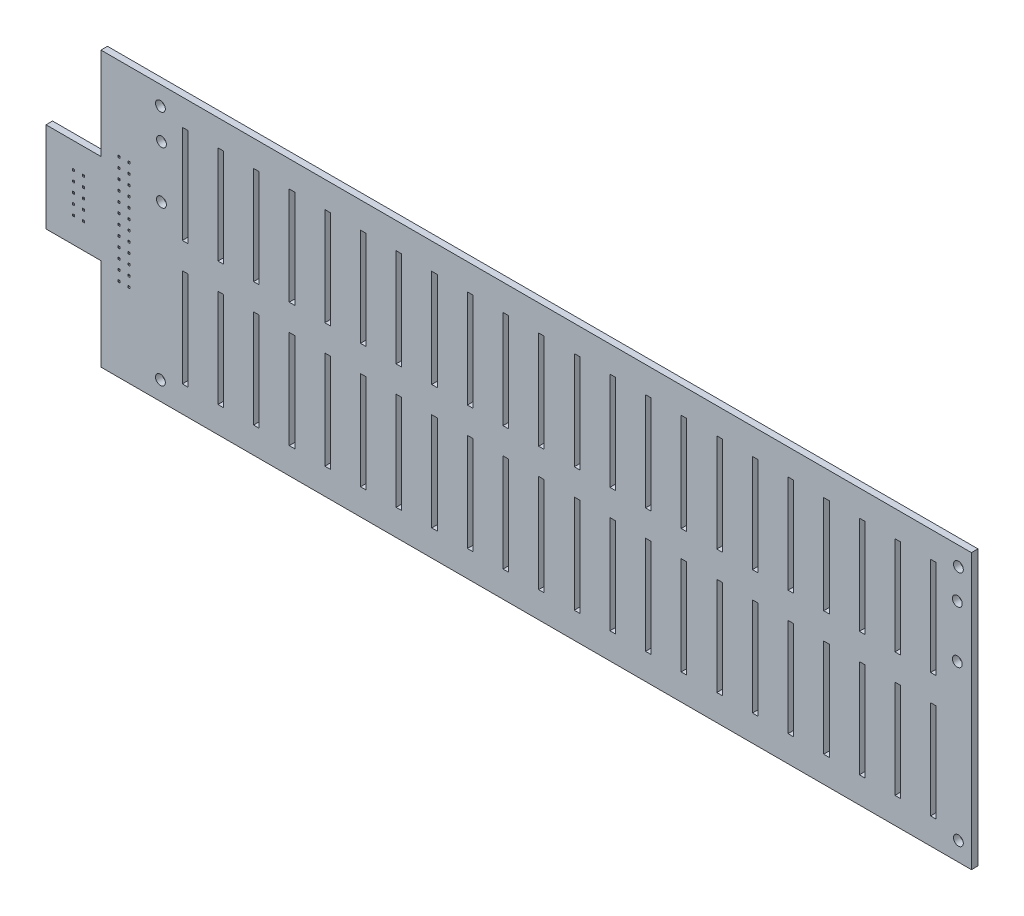
from build123d import *

# Parameters (mm, degrees)
MODEL_R             = 1.5
MODEL_W             = 0.64
MODEL_H             = 0.64
MODEL_W_2           = 1.7
MODEL_H_2           = 30
BOSS_EXTRUDE1_DEPTH = 2


with BuildPart() as part:
    # Model → Boss-Extrude1 (new body)
    with BuildSketch(Plane.XY):
        Polygon((-140.24, -42), (126.05, -42), (126.05, 42), (-140.24, 42), (-140.24, 13.8), (-157.05, 13.8), (-157.05, -13.8), (-140.24, -13.8), align=None)
        with Locations((-122.05, 36.25)):
            Circle(MODEL_R, mode=Mode.SUBTRACT)
        with Locations((-122.05, -36.25)):
            Circle(MODEL_R, mode=Mode.SUBTRACT)
        with Locations((122.05, -36.25)):
            Circle(MODEL_R, mode=Mode.SUBTRACT)
        with Locations((122.05, 36.25)):
            Circle(MODEL_R, mode=Mode.SUBTRACT)
        with Locations((121.73, 27)):
            Circle(MODEL_R, mode=Mode.SUBTRACT)
        with Locations((121.73, 11)):
            Circle(MODEL_R, mode=Mode.SUBTRACT)
        with Locations((-121.73, 11)):
            Circle(MODEL_R, mode=Mode.SUBTRACT)
        with Locations((-121.73, 27)):
            Circle(MODEL_R, mode=Mode.SUBTRACT)
        with Locations((-131.71, -1.5)):
            Rectangle(MODEL_W, MODEL_H, mode=Mode.SUBTRACT)
        with Locations((-134.71, 1.5)):
            Rectangle(MODEL_W, MODEL_H, mode=Mode.SUBTRACT)
        with Locations((-131.71, 1.5)):
            Rectangle(MODEL_W, MODEL_H, mode=Mode.SUBTRACT)
        with Locations((-134.71, 4.5)):
            Rectangle(MODEL_W, MODEL_H, mode=Mode.SUBTRACT)
        with Locations((-131.71, -7.5)):
            Rectangle(MODEL_W, MODEL_H, mode=Mode.SUBTRACT)
        with Locations((-134.71, -4.5)):
            Rectangle(MODEL_W, MODEL_H, mode=Mode.SUBTRACT)
        with Locations((-131.71, -4.5)):
            Rectangle(MODEL_W, MODEL_H, mode=Mode.SUBTRACT)
        with Locations((-134.71, -1.5)):
            Rectangle(MODEL_W, MODEL_H, mode=Mode.SUBTRACT)
        with Locations((-134.71, 10.5)):
            Rectangle(MODEL_W, MODEL_H, mode=Mode.SUBTRACT)
        with Locations((-134.71, 13.5)):
            Rectangle(MODEL_W, MODEL_H, mode=Mode.SUBTRACT)
        with Locations((-131.71, 13.5)):
            Rectangle(MODEL_W, MODEL_H, mode=Mode.SUBTRACT)
        with Locations((-134.71, 16.5)):
            Rectangle(MODEL_W, MODEL_H, mode=Mode.SUBTRACT)
        with Locations((-131.71, 4.5)):
            Rectangle(MODEL_W, MODEL_H, mode=Mode.SUBTRACT)
        with Locations((-134.71, 7.5)):
            Rectangle(MODEL_W, MODEL_H, mode=Mode.SUBTRACT)
        with Locations((-131.71, 7.5)):
            Rectangle(MODEL_W, MODEL_H, mode=Mode.SUBTRACT)
        with Locations((-131.71, 10.5)):
            Rectangle(MODEL_W, MODEL_H, mode=Mode.SUBTRACT)
        with Locations((-145.58, 0)):
            Rectangle(MODEL_W, MODEL_H, mode=Mode.SUBTRACT)
        with Locations((-148.58, 3)):
            Rectangle(MODEL_W, MODEL_H, mode=Mode.SUBTRACT)
        with Locations((-145.58, 3)):
            Rectangle(MODEL_W, MODEL_H, mode=Mode.SUBTRACT)
        with Locations((-148.58, 6)):
            Rectangle(MODEL_W, MODEL_H, mode=Mode.SUBTRACT)
        with Locations((-145.58, -6)):
            Rectangle(MODEL_W, MODEL_H, mode=Mode.SUBTRACT)
        with Locations((-148.58, -3)):
            Rectangle(MODEL_W, MODEL_H, mode=Mode.SUBTRACT)
        with Locations((-145.58, -3)):
            Rectangle(MODEL_W, MODEL_H, mode=Mode.SUBTRACT)
        with Locations((-148.58, 0)):
            Rectangle(MODEL_W, MODEL_H, mode=Mode.SUBTRACT)
        with Locations((-131.71, -13.5)):
            Rectangle(MODEL_W, MODEL_H, mode=Mode.SUBTRACT)
        with Locations((-134.71, -10.5)):
            Rectangle(MODEL_W, MODEL_H, mode=Mode.SUBTRACT)
        with Locations((-131.71, -10.5)):
            Rectangle(MODEL_W, MODEL_H, mode=Mode.SUBTRACT)
        with Locations((-134.71, -7.5)):
            Rectangle(MODEL_W, MODEL_H, mode=Mode.SUBTRACT)
        with Locations((-145.58, 6)):
            Rectangle(MODEL_W, MODEL_H, mode=Mode.SUBTRACT)
        with Locations((-134.71, -16.5)):
            Rectangle(MODEL_W, MODEL_H, mode=Mode.SUBTRACT)
        with Locations((-131.71, -16.5)):
            Rectangle(MODEL_W, MODEL_H, mode=Mode.SUBTRACT)
        with Locations((-134.71, -13.5)):
            Rectangle(MODEL_W, MODEL_H, mode=Mode.SUBTRACT)
        with Locations((-131.71, 16.5)):
            Rectangle(MODEL_W, MODEL_H, mode=Mode.SUBTRACT)
        with Locations((-148.58, -6)):
            Rectangle(MODEL_W, MODEL_H, mode=Mode.SUBTRACT)
        with Locations((-103.6, 19)):
            Rectangle(MODEL_W_2, MODEL_H_2, mode=Mode.SUBTRACT)
        with Locations((-92.7, 19)):
            Rectangle(MODEL_W_2, MODEL_H_2, mode=Mode.SUBTRACT)
        with Locations((-81.8, 19)):
            Rectangle(MODEL_W_2, MODEL_H_2, mode=Mode.SUBTRACT)
        with Locations((-70.9, 19)):
            Rectangle(MODEL_W_2, MODEL_H_2, mode=Mode.SUBTRACT)
        with Locations((-60, 19)):
            Rectangle(MODEL_W_2, MODEL_H_2, mode=Mode.SUBTRACT)
        with Locations((-49.1, 19)):
            Rectangle(MODEL_W_2, MODEL_H_2, mode=Mode.SUBTRACT)
        with Locations((-38.2, 19)):
            Rectangle(MODEL_W_2, MODEL_H_2, mode=Mode.SUBTRACT)
        with Locations((-27.3, 19)):
            Rectangle(MODEL_W_2, MODEL_H_2, mode=Mode.SUBTRACT)
        with Locations((-16.4, 19)):
            Rectangle(MODEL_W_2, MODEL_H_2, mode=Mode.SUBTRACT)
        with Locations((-114.5, 19)):
            Rectangle(MODEL_W_2, MODEL_H_2, mode=Mode.SUBTRACT)
        with Locations((-5.5, 19)):
            Rectangle(MODEL_W_2, MODEL_H_2, mode=Mode.SUBTRACT)
        with Locations((5.4, 19)):
            Rectangle(MODEL_W_2, MODEL_H_2, mode=Mode.SUBTRACT)
        with Locations((16.3, 19)):
            Rectangle(MODEL_W_2, MODEL_H_2, mode=Mode.SUBTRACT)
        with Locations((27.2, 19)):
            Rectangle(MODEL_W_2, MODEL_H_2, mode=Mode.SUBTRACT)
        with Locations((38.1, 19)):
            Rectangle(MODEL_W_2, MODEL_H_2, mode=Mode.SUBTRACT)
        with Locations((49, 19)):
            Rectangle(MODEL_W_2, MODEL_H_2, mode=Mode.SUBTRACT)
        with Locations((59.9, 19)):
            Rectangle(MODEL_W_2, MODEL_H_2, mode=Mode.SUBTRACT)
        with Locations((70.8, 19)):
            Rectangle(MODEL_W_2, MODEL_H_2, mode=Mode.SUBTRACT)
        with Locations((81.7, 19)):
            Rectangle(MODEL_W_2, MODEL_H_2, mode=Mode.SUBTRACT)
        with Locations((92.6, 19)):
            Rectangle(MODEL_W_2, MODEL_H_2, mode=Mode.SUBTRACT)
        with Locations((103.5, 19)):
            Rectangle(MODEL_W_2, MODEL_H_2, mode=Mode.SUBTRACT)
        with Locations((114.4, 19)):
            Rectangle(MODEL_W_2, MODEL_H_2, mode=Mode.SUBTRACT)
        with Locations((114.4, -19)):
            Rectangle(MODEL_W_2, MODEL_H_2, mode=Mode.SUBTRACT)
        with Locations((103.5, -19)):
            Rectangle(MODEL_W_2, MODEL_H_2, mode=Mode.SUBTRACT)
        with Locations((92.6, -19)):
            Rectangle(MODEL_W_2, MODEL_H_2, mode=Mode.SUBTRACT)
        with Locations((81.7, -19)):
            Rectangle(MODEL_W_2, MODEL_H_2, mode=Mode.SUBTRACT)
        with Locations((70.8, -19)):
            Rectangle(MODEL_W_2, MODEL_H_2, mode=Mode.SUBTRACT)
        with Locations((59.9, -19)):
            Rectangle(MODEL_W_2, MODEL_H_2, mode=Mode.SUBTRACT)
        with Locations((49, -19)):
            Rectangle(MODEL_W_2, MODEL_H_2, mode=Mode.SUBTRACT)
        with Locations((38.1, -19)):
            Rectangle(MODEL_W_2, MODEL_H_2, mode=Mode.SUBTRACT)
        with Locations((27.2, -19)):
            Rectangle(MODEL_W_2, MODEL_H_2, mode=Mode.SUBTRACT)
        with Locations((16.3, -19)):
            Rectangle(MODEL_W_2, MODEL_H_2, mode=Mode.SUBTRACT)
        with Locations((5.4, -19)):
            Rectangle(MODEL_W_2, MODEL_H_2, mode=Mode.SUBTRACT)
        with Locations((-5.5, -19)):
            Rectangle(MODEL_W_2, MODEL_H_2, mode=Mode.SUBTRACT)
        with Locations((-114.5, -19)):
            Rectangle(MODEL_W_2, MODEL_H_2, mode=Mode.SUBTRACT)
        with Locations((-16.4, -19)):
            Rectangle(MODEL_W_2, MODEL_H_2, mode=Mode.SUBTRACT)
        with Locations((-27.3, -19)):
            Rectangle(MODEL_W_2, MODEL_H_2, mode=Mode.SUBTRACT)
        with Locations((-38.2, -19)):
            Rectangle(MODEL_W_2, MODEL_H_2, mode=Mode.SUBTRACT)
        with Locations((-49.1, -19)):
            Rectangle(MODEL_W_2, MODEL_H_2, mode=Mode.SUBTRACT)
        with Locations((-60, -19)):
            Rectangle(MODEL_W_2, MODEL_H_2, mode=Mode.SUBTRACT)
        with Locations((-70.9, -19)):
            Rectangle(MODEL_W_2, MODEL_H_2, mode=Mode.SUBTRACT)
        with Locations((-81.8, -19)):
            Rectangle(MODEL_W_2, MODEL_H_2, mode=Mode.SUBTRACT)
        with Locations((-92.7, -19)):
            Rectangle(MODEL_W_2, MODEL_H_2, mode=Mode.SUBTRACT)
        with Locations((-103.6, -19)):
            Rectangle(MODEL_W_2, MODEL_H_2, mode=Mode.SUBTRACT)
    extrude(amount=BOSS_EXTRUDE1_DEPTH)


solid = part.part
